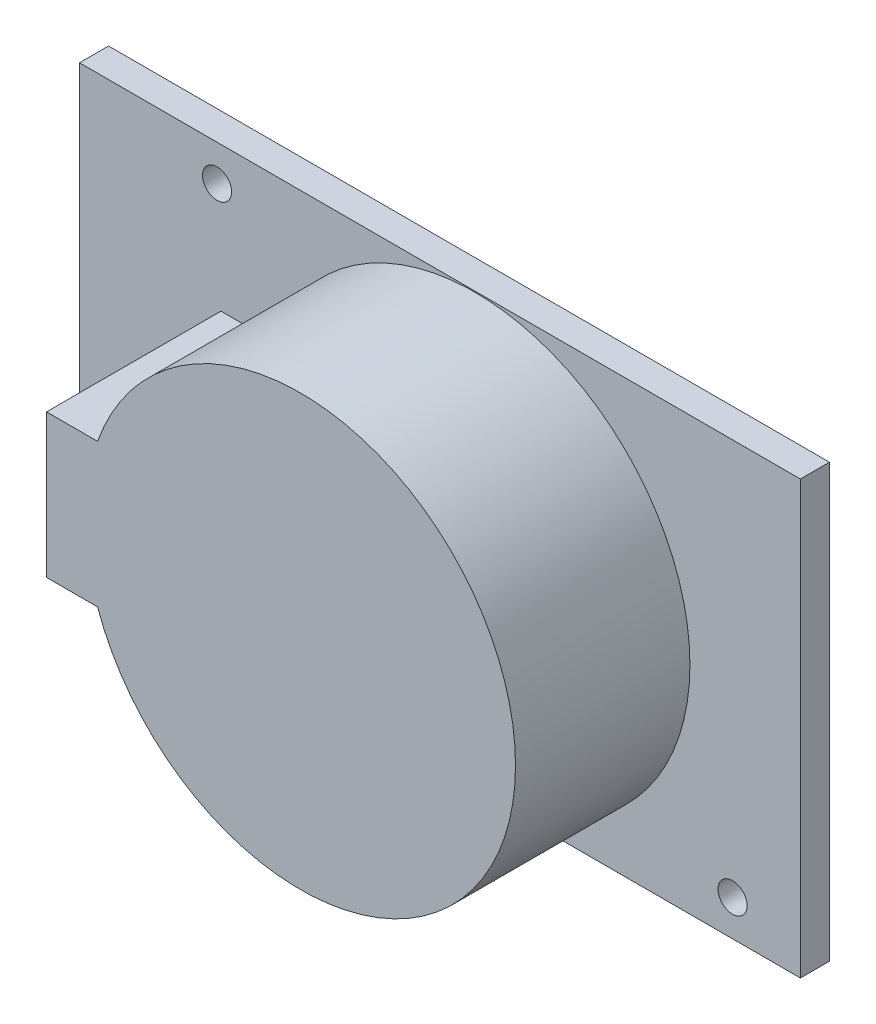
from build123d import *

# Parameters (mm, degrees)
SKETCH_1_W          = 37.2
SKETCH_1_H          = 22.3
SKETCH_1_R          = 0.75
EXTRUDE_1_DEPTH     = 5
SKETCH_1_3_W        = 37.2
SKETCH_1_3_H        = 22.3
SKETCH_1_3_R        = 0.75
CUT_EXTRUDE_2_DEPTH = 3.5
EXTRUDE_3_DEPTH     = 9
SKETCH_4_W          = 10.4
SKETCH_4_H          = 7.5
EXTRUDE_4_DEPTH     = 3.5


with BuildPart() as part:
    # 草圖1 → 填料-伸長1 (new body)
    with BuildSketch(Plane.XY):
        with Locations((63.739258578, 17.893460251)):
            Rectangle(SKETCH_1_W, SKETCH_1_H)
        with Locations((78.839258578, 8.593460251)):
            Circle(SKETCH_1_R, mode=Mode.SUBTRACT)
        with Locations((52.239258578, 27.193460251)):
            Circle(SKETCH_1_R, mode=Mode.SUBTRACT)
        with Locations((52.239258578, 8.593460251)):
            Circle(SKETCH_1_R, mode=Mode.SUBTRACT)
    extrude(amount=EXTRUDE_1_DEPTH)

    # 草圖1<3> → 除料-伸長2 (cut)
    with BuildSketch(Plane.XY):
        with Locations((63.739258578, 17.893460251)):
            Rectangle(SKETCH_1_3_W, SKETCH_1_3_H)
        with Locations((78.839258578, 8.593460251)):
            Circle(SKETCH_1_3_R, mode=Mode.SUBTRACT)
        with Locations((52.239258578, 27.193460251)):
            Circle(SKETCH_1_3_R, mode=Mode.SUBTRACT)
        with Locations((52.239258578, 8.593460251)):
            Circle(SKETCH_1_3_R, mode=Mode.SUBTRACT)
    extrude(amount=CUT_EXTRUDE_2_DEPTH, mode=Mode.SUBTRACT)

    # 草圖3 → 填料-伸長3 (add)
    with BuildSketch(Plane.XY.offset(5)):
        with BuildLine():
            Line((52.439258578, 14.193460251), (55.074078216, 14.193460251))
            ThreePointArc((55.074078216, 14.193460251), (76.639258578, 17.893460251), (55.074078216, 21.593460251))
            Line((55.074078216, 21.593460251), (52.439258578, 21.593460251))
            Line((52.439258578, 21.593460251), (52.439258578, 14.193460251))
        make_face()
    extrude(amount=EXTRUDE_3_DEPTH)

    # 草圖4 → 填料-伸長4 (add)
    with BuildSketch(Plane(origin=(0, 0, 3.5), x_dir=(-1, 0, 0), z_dir=(0, 0, -1))):
        with Locations((-66.639258578, 13.993460251)):
            Rectangle(SKETCH_4_W, SKETCH_4_H)
    extrude(amount=EXTRUDE_4_DEPTH)


solid = part.part
